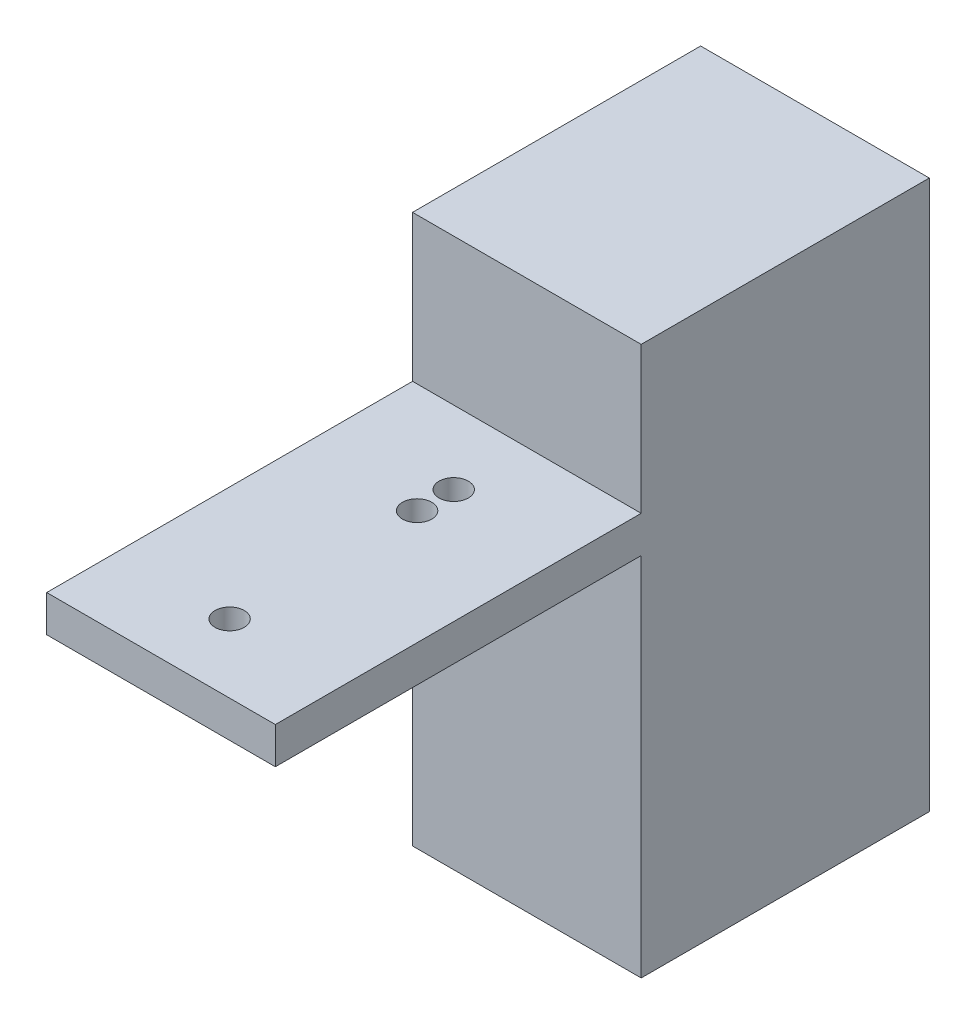
from build123d import *

# Parameters (mm, degrees)
SKETCH1_W           = 27.5
SKETCH1_H           = 40
BOSS_EXTRUDE1_DEPTH = 12.5
SKETCH2_W           = 5.015
SKETCH2_H           = 40.03
SKETCH2_W_2         = 10
CUT_EXTRUDE1_DEPTH  = 13.765
SKETCH6_R           = 3.25
CUT_EXTRUDE2_DEPTH  = 12
SKETCH7_R           = 1.6
CUT_EXTRUDE3_DEPTH  = 61.763887302


with BuildPart() as part:
    # Sketch1 → Boss-Extrude1 (new, symmetric)
    with BuildSketch(Plane(origin=(0, 0, 0), x_dir=(0, 0, -1), z_dir=(1, 0, 0))):
        with Locations((17.75, 20)):
            Rectangle(SKETCH1_W, SKETCH1_H)
        Polygon((0, -10), (0, 30), (-40, 30), (-40, 34), (0, 34), (0, 50), (31.5, 50), (31.5, 40), (4, 40), (4, 0), (31.5, 0), (31.5, -10), align=None)
    extrude(amount=BOSS_EXTRUDE1_DEPTH, both=True)

    # Sketch2 → Cut-Extrude1 (cut, symmetric)
    with BuildSketch(Plane(origin=(0, 0, -31.5), x_dir=(-1, 0, 0), z_dir=(0, 0, -1))):
        with Locations((7.5075, 20)):
            Rectangle(SKETCH2_W, SKETCH2_H)
        with Locations((0, 20)):
            Rectangle(SKETCH2_W_2, SKETCH2_H)
        with Locations((-7.5075, 20)):
            Rectangle(SKETCH2_W, SKETCH2_H)
    extrude(amount=CUT_EXTRUDE1_DEPTH, both=True, mode=Mode.SUBTRACT)

    # Sketch6 → Cut-Extrude2 (cut)
    with BuildSketch(Plane(origin=(0, 0, -31.5), x_dir=(-1, 0, 0), z_dir=(0, 0, -1))):
        with Locations(Location((-5, 44, 0), (0, 0, 90))):
            Circle(SKETCH6_R)
        with Locations(Location((5, 44, 0), (0, 0, 90))):
            Circle(SKETCH6_R)
        with Locations(Location((5, -4, 0), (0, 0, 90))):
            Circle(SKETCH6_R)
        with Locations(Location((-5, -4, 0), (0, 0, 90))):
            Circle(SKETCH6_R)
    extrude(amount=-CUT_EXTRUDE2_DEPTH, mode=Mode.SUBTRACT)

    # Sketch7 → Cut-Extrude3 (cut, through all)
    with BuildSketch(Plane(origin=(0, 34, 0), x_dir=(1, 0, 0), z_dir=(0, 1, 0))):
        with Locations(Location((0, -32.5, 0), (0, 0, 270))):
            Circle(SKETCH7_R)
        with Locations(Location((0, -12, 0), (0, 0, 270))):
            Circle(SKETCH7_R)
        with Locations(Location((0, -8, 0), (0, 0, 270))):
            Circle(SKETCH7_R)
    extrude(amount=-CUT_EXTRUDE3_DEPTH, mode=Mode.SUBTRACT)


solid = part.part
